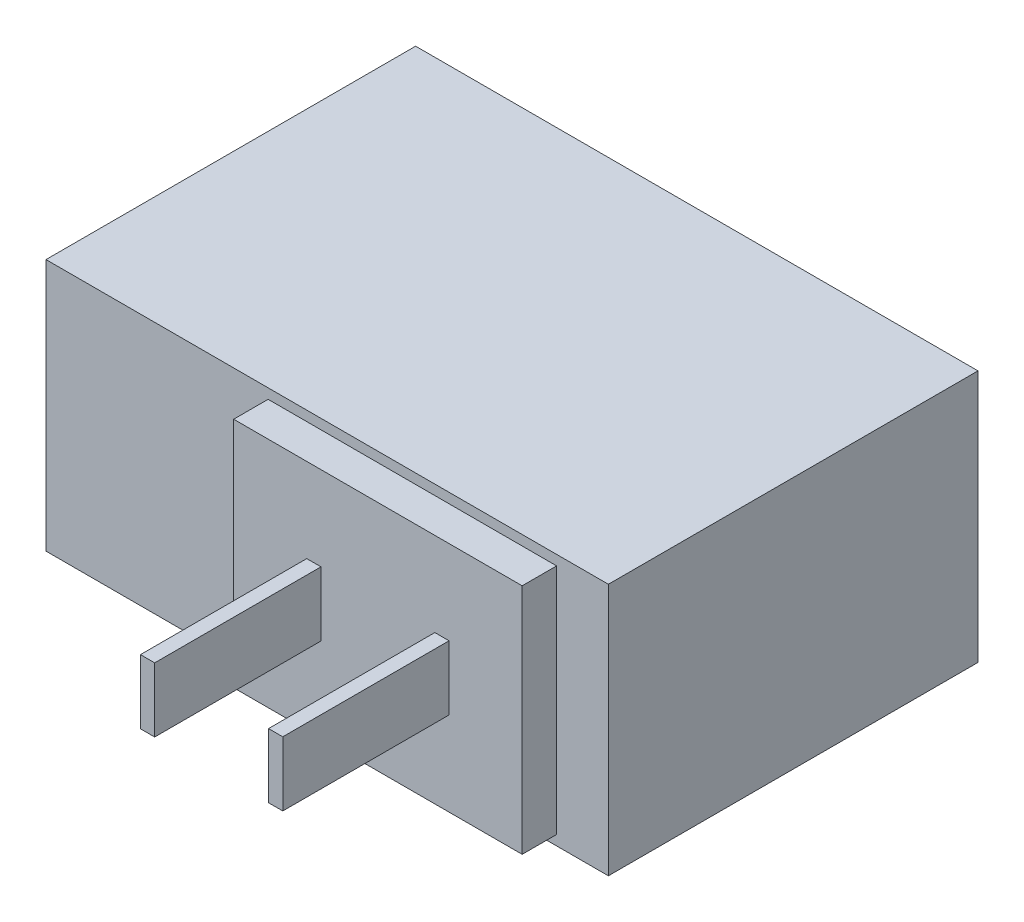
from build123d import *

# Parameters (mm, degrees)
SKETCH1_W           = 55.32
SKETCH1_H           = 24.84
BOSS_EXTRUDE1_DEPTH = 36.36
SKETCH2_W           = 28.38
SKETCH2_H           = 22.88
BOSS_EXTRUDE2_DEPTH = 3.39
SKETCH3_W           = 1.4
SKETCH3_H           = 6.32
BOSS_EXTRUDE3_DEPTH = 16.36


with BuildPart() as part:
    # Sketch1 → Boss-Extrude1 (new body)
    with BuildSketch(Plane.XY):
        Rectangle(SKETCH1_W, SKETCH1_H)
    extrude(amount=BOSS_EXTRUDE1_DEPTH)

    # Sketch2 → Boss-Extrude2 (add)
    with BuildSketch(Plane.XY.offset(36.36)):
        with Locations((8.38, 0)):
            Rectangle(SKETCH2_W, SKETCH2_H)
    extrude(amount=BOSS_EXTRUDE2_DEPTH)

    # Sketch3 → Boss-Extrude3 (add)
    with BuildSketch(Plane.XY.offset(39.75)):
        with Locations((14.68, 0)):
            Rectangle(SKETCH3_W, SKETCH3_H)
        with Locations((2.08, 0)):
            Rectangle(SKETCH3_W, SKETCH3_H)
    extrude(amount=BOSS_EXTRUDE3_DEPTH)


solid = part.part
